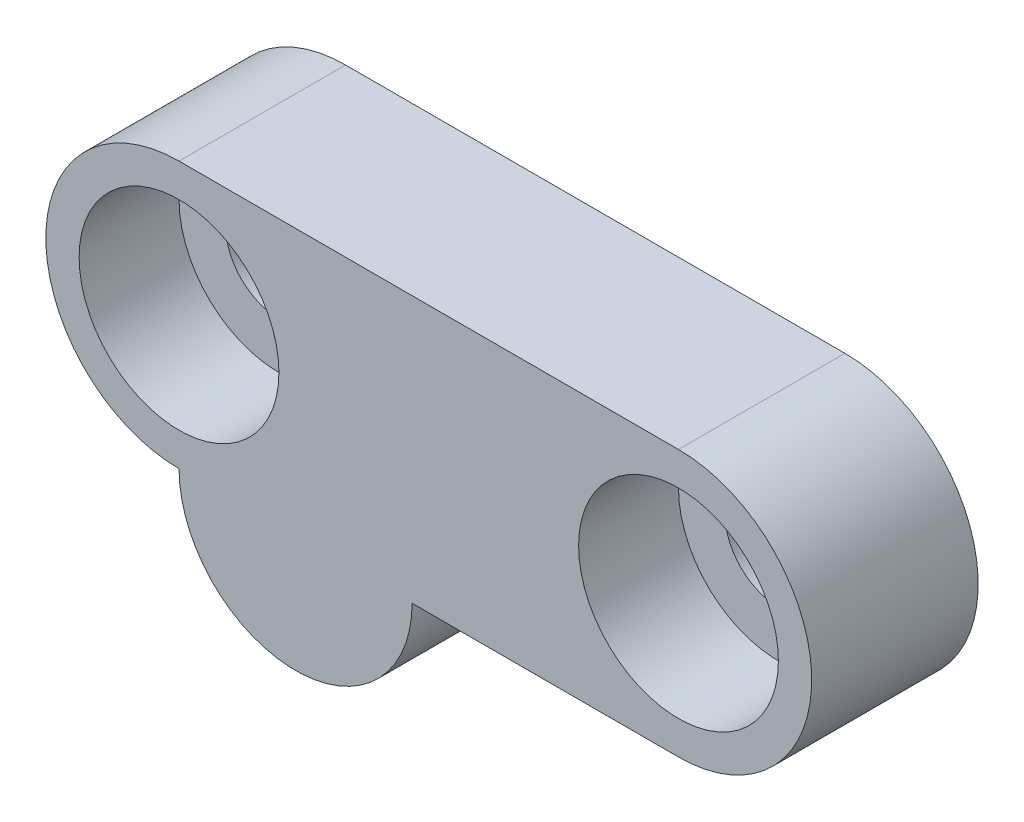
from build123d import *

# Parameters (mm, degrees)
SKETCH1_R           = 1.6
BOSS_EXTRUDE1_DEPTH = 5
SKETCH2_R           = 3
CUT_EXTRUDE1_DEPTH  = 3


with BuildPart() as part:
    # Sketch1 → Boss-Extrude1 (new body)
    with BuildSketch(Plane.XY.offset(22)):
        with BuildLine():
            Line((0, 4), (15, 4))
            ThreePointArc((15, 4), (19, 0), (15, -4))
            Line((15, -4), (7, -4))
            ThreePointArc((7, -4), (3.5, -7.5), (0, -4))
            ThreePointArc((0, -4), (-4, 0), (0, 4))
        make_face()
        Circle(SKETCH1_R, mode=Mode.SUBTRACT)
        with Locations((15, 0)):
            Circle(SKETCH1_R, mode=Mode.SUBTRACT)
    extrude(amount=BOSS_EXTRUDE1_DEPTH)

    # Sketch2 → Cut-Extrude1 (cut)
    with BuildSketch(Plane.XY.offset(27)):
        Circle(SKETCH2_R)
        with Locations((15, 0)):
            Circle(SKETCH2_R)
    extrude(amount=-CUT_EXTRUDE1_DEPTH, mode=Mode.SUBTRACT)


solid = part.part
